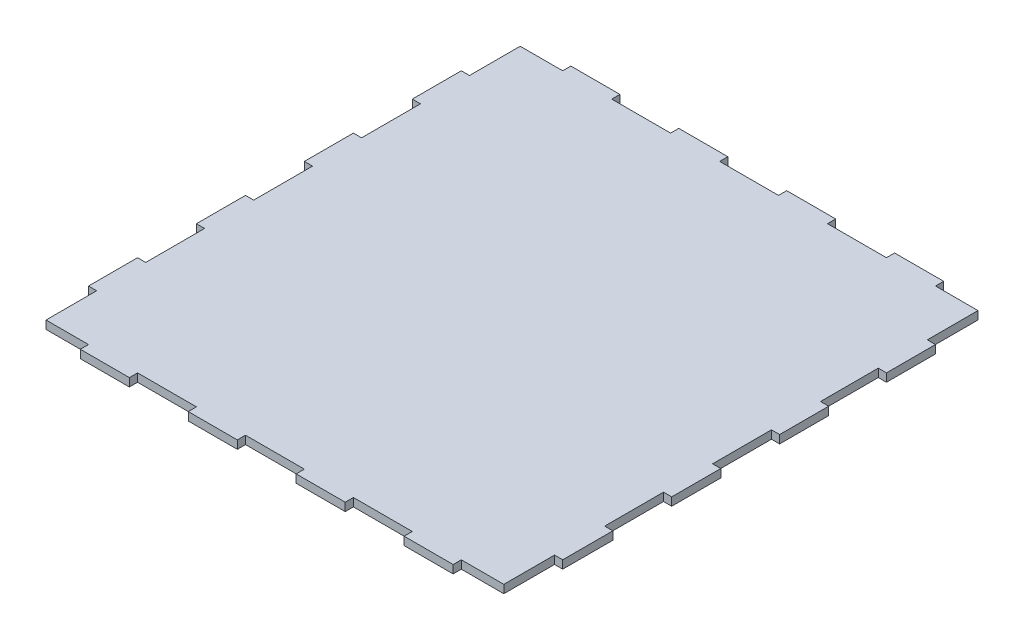
from build123d import *

# Parameters (mm, degrees)
BOSS_EXTRUDE1_DEPTH = 2.5


with BuildPart() as part:
    # Sketch1 → Boss-Extrude1 (new, symmetric)
    with BuildSketch(Plane(origin=(0, 0, 0), x_dir=(1, 0, 0), z_dir=(0, 1, 0))):
        Polygon((114, 145), (114, 150), (84, 150), (84, 145), (48, 145), (48, 150), (18, 150), (18, 145), (-18, 145), (-18, 150), (-48, 150), (-48, 145), (-84, 145), (-84, 150), (-114, 150), (-114, 145), (-140, 145), (-140, 114), (-145, 114), (-145, 84), (-140, 84), (-140, 48), (-145, 48), (-145, 18), (-140, 18), (-140, -18), (-145, -18), (-145, -48), (-140, -48), (-140, -84), (-145, -84), (-145, -114), (-140, -114), (-140, -145), (-114, -145), (-114, -150), (-84, -150), (-84, -145), (-48, -145), (-48, -150), (-18, -150), (-18, -145), (18, -145), (18, -150), (48, -150), (48, -145), (84, -145), (84, -150), (114, -150), (114, -145), (140, -145), (140, -114), (145, -114), (145, -83.328035024), (140, -83.328035024), (140, -47.328035024), (145, -47.328035024), (145, -17.328035024), (140, -17.328035024), (140, 18.671964976), (145, 18.671964976), (145, 48.671964976), (140, 48.671964976), (140, 84), (145, 84), (145, 114), (140, 114), (140, 145), align=None)
    extrude(amount=BOSS_EXTRUDE1_DEPTH, both=True)


solid = part.part
